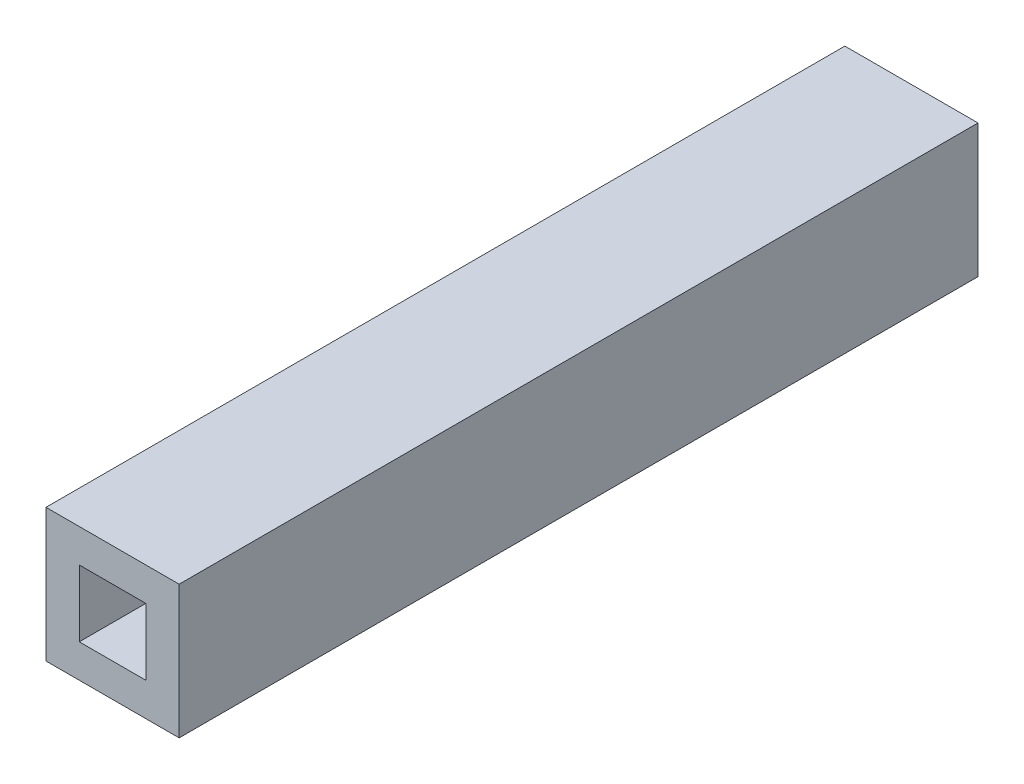
from build123d import *

# Parameters (mm, degrees)
SKETCH1_W           = 25.4
SKETCH1_H           = 25.4
SKETCH1_W_2         = 12.7
SKETCH1_H_2         = 12.7
BOSS_EXTRUDE1_DEPTH = 152.4


with BuildPart() as part:
    # Sketch1 → Boss-Extrude1 (new body)
    with BuildSketch(Plane.XY):
        with Locations((-12.7, 12.7)):
            Rectangle(SKETCH1_W, SKETCH1_H)
        with Locations((-12.7, 12.7)):
            Rectangle(SKETCH1_W_2, SKETCH1_H_2, mode=Mode.SUBTRACT)
    extrude(amount=BOSS_EXTRUDE1_DEPTH)


solid = part.part
